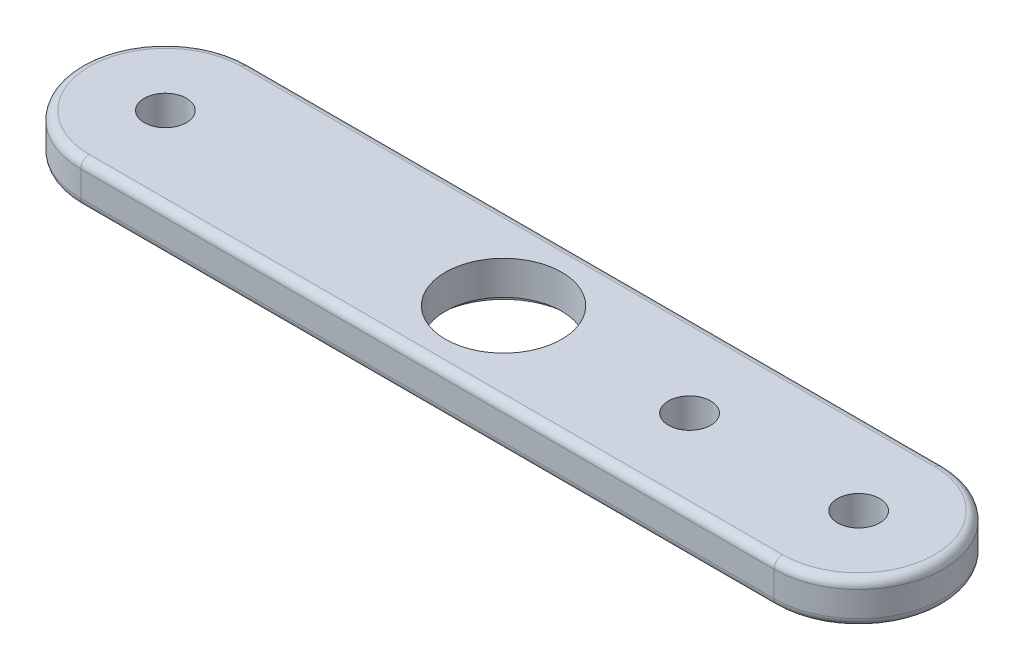
from build123d import *

# Parameters (mm, degrees)
SKETCH1_W           = 129.54
SKETCH1_H           = 25.4
BOSS_EXTRUDE1_DEPTH = 6.35
SKETCH2_R           = 3.175
SKETCH2_R_2         = 8.73125
CUT_EXTRUDE1_DEPTH  = 67.30810961
SKETCH3_R           = 10.16
CUT_EXTRUDE2_DEPTH  = 1.27
CUT_EXTRUDE3_DEPTH  = 67.30810961
FILLET1_R           = 1.27


with BuildPart() as part:
    # Sketch1 → Boss-Extrude1 (new body)
    with BuildSketch(Plane(origin=(0, 0, 0), x_dir=(1, 0, 0), z_dir=(0, 1, 0))):
        Rectangle(SKETCH1_W, SKETCH1_H)
    extrude(amount=BOSS_EXTRUDE1_DEPTH)

    # Sketch2 → Cut-Extrude1 (cut, through all)
    with BuildSketch(Plane(origin=(0, 6.35, 0), x_dir=(1, 0, 0), z_dir=(0, 1, 0))):
        with Locations(Location((-52.07, 0, 0), (0, 0, 270))):
            Circle(SKETCH2_R)
        with Locations(Location((26.67, 0, 0), (0, 0, 270))):
            Circle(SKETCH2_R)
        with Locations(Location((52.07, 0, 0), (0, 0, 270))):
            Circle(SKETCH2_R)
        with Locations(Location((-1.27, 0, 0), (0, 0, 270))):
            Circle(SKETCH2_R_2)
    extrude(amount=-CUT_EXTRUDE1_DEPTH, mode=Mode.SUBTRACT)

    # Sketch3 → Cut-Extrude2 (cut)
    with BuildSketch(Plane(origin=(0, 0, 0), x_dir=(-1, 0, 0), z_dir=(0, -1, 0))):
        with Locations(Location((1.27, 0, 0), (0, 0, 90))):
            Circle(SKETCH3_R)
    extrude(amount=-CUT_EXTRUDE2_DEPTH, mode=Mode.SUBTRACT)

    # Sketch5 → Cut-Extrude3 (cut, through all)
    with BuildSketch(Plane(origin=(0, 6.35, 0), x_dir=(1, 0, 0), z_dir=(0, 1, 0))):
        with BuildLine():
            ThreePointArc((-64.77, -3.9e-08), (-61.050256152, 8.98025609), (-52.070000049, 12.7))
            Line((-52.070000049, 12.7), (-64.77, 12.7))
            Line((-64.77, 12.7), (-64.77, -3.9e-08))
        make_face()
        with BuildLine():
            Line((-64.77, -12.7), (-52.07, -12.7))
            ThreePointArc((-52.07, -12.7), (-61.050256107, -8.980256135), (-64.77, -3.9e-08))
            Line((-64.77, -3.9e-08), (-64.77, -12.7))
        make_face()
        with BuildLine():
            ThreePointArc((64.77, 0), (61.050256132, -8.98025611), (52.07000003, -12.7))
            Line((52.07000003, -12.7), (64.77, -12.7))
            Line((64.77, -12.7), (64.77, 0))
        make_face()
        with BuildLine():
            Line((64.77, 12.7), (52.07, 12.7))
            ThreePointArc((52.07, 12.7), (61.050256121, 8.980256121), (64.77, 0))
            Line((64.77, 0), (64.77, 12.7))
        make_face()
    extrude(amount=-CUT_EXTRUDE3_DEPTH, mode=Mode.SUBTRACT)

    # Fillet1
    fillet1_edges = [part.edges().sort_by_distance(p)[0] for p in [
        (-2.4e-08, 0, -12.7),
        (-2.4e-08, 6.35, -12.7),
        (-64.77, 6.35, 2.4e-08),
        (-64.77, 0, 2.4e-08),
        (64.77, 6.35, -1.5e-08),
        (64.77, 0, -1.5e-08),
        (1.5e-08, 0, 12.7),
        (1.5e-08, 6.35, 12.7),
    ]]
    fillet(fillet1_edges, radius=FILLET1_R)


solid = part.part
